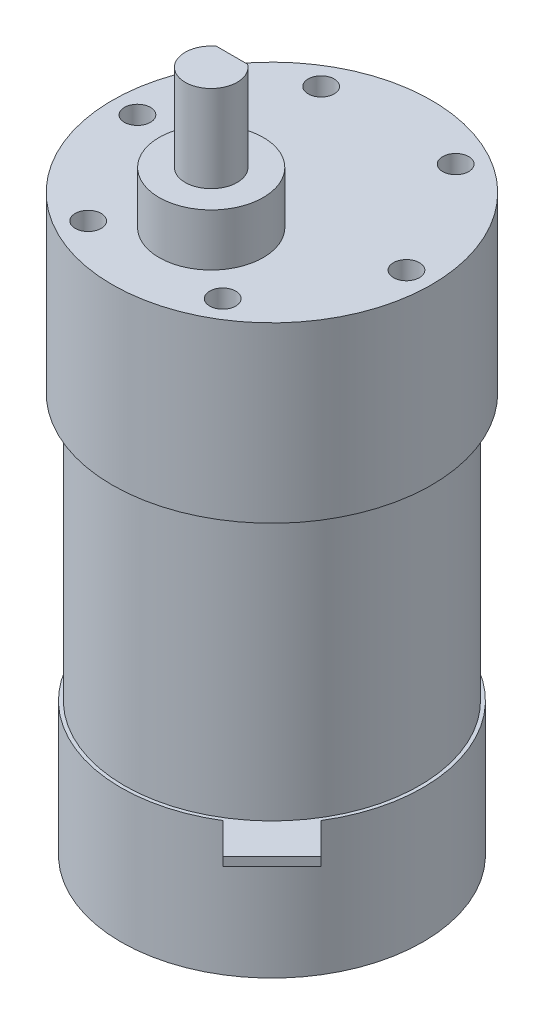
from build123d import *

# Parameters (mm, degrees)
SKETCH1_R           = 17.4
BOSS_EXTRUDE1_DEPTH = 15.4
SKETCH6_R           = 17
BOSS_EXTRUDE5_DEPTH = 30.7
SKETCH7_R           = 18.4
BOSS_EXTRUDE6_DEPTH = 20
SKETCH2_R           = 6
BOSS_EXTRUDE2_DEPTH = 6
SKETCH3_R           = 3
BOSS_EXTRUDE4_DEPTH = 10
SKETCH4_W           = 6
SKETCH4_H           = 8
CUT_EXTRUDE1_DEPTH  = 10
BOSS_EXTRUDE7_DEPTH = 1
SKETCH5_R           = 1.5
CUT_EXTRUDE2_DEPTH  = 3


with BuildPart() as part:
    # Sketch1 → Boss-Extrude1 (new body)
    with BuildSketch(Plane(origin=(0, 0, 0), x_dir=(1, 0, 0), z_dir=(0, 1, 0))):
        Circle(SKETCH1_R)
    extrude(amount=BOSS_EXTRUDE1_DEPTH)

    # Sketch6 → Boss-Extrude5 (add)
    with BuildSketch(Plane(origin=(0, 15.4, 0), x_dir=(1, 0, 0), z_dir=(0, 1, 0))):
        Circle(SKETCH6_R)
    extrude(amount=BOSS_EXTRUDE5_DEPTH)

    # Sketch7 → Boss-Extrude6 (add)
    with BuildSketch(Plane(origin=(0, 46.1, 0), x_dir=(1, 0, 0), z_dir=(0, 1, 0))):
        Circle(SKETCH7_R)
    extrude(amount=BOSS_EXTRUDE6_DEPTH)

    # Sketch2 → Boss-Extrude2 (add)
    with BuildSketch(Plane(origin=(0, 66.1, 0), x_dir=(1, 0, 0), z_dir=(0, 1, 0))):
        with Locations((0, -7)):
            Circle(SKETCH2_R)
    extrude(amount=BOSS_EXTRUDE2_DEPTH)

    # Sketch3 → Boss-Extrude4 (add)
    with BuildSketch(Plane(origin=(0, 72.1, 0), x_dir=(1, 0, 0), z_dir=(0, 1, 0))):
        with Locations((0, -7)):
            Circle(SKETCH3_R)
    extrude(amount=BOSS_EXTRUDE4_DEPTH)

    # Sketch4 → Cut-Extrude1 (cut)
    with BuildSketch(Plane.XY.offset(4.6)):
        with Locations((0, 78.1)):
            Rectangle(SKETCH4_W, SKETCH4_H)
    extrude(amount=-CUT_EXTRUDE1_DEPTH, mode=Mode.SUBTRACT)

    # Sketch8 → Boss-Extrude7 (add)
    with BuildSketch(Plane.XZ.offset(-15.4)):
        Polygon((2.828427125, -2.828427125), (-2.828427125, 2.828427125), (12.727922061, 18.384776311), (18.384776311, 12.727922061), align=None)
    extrude(amount=BOSS_EXTRUDE7_DEPTH)

    # Sketch5 → Cut-Extrude2 (cut)
    with BuildSketch(Plane(origin=(0, 66.1, 0), x_dir=(1, 0, 0), z_dir=(0, 1, 0))):
        with Locations((-7.75, 13.423393759)):
            Circle(SKETCH5_R)
        with Locations((7.75, 13.423393759)):
            Circle(SKETCH5_R)
        with Locations((-15.5, 0)):
            Circle(SKETCH5_R)
        with Locations((15.5, 0)):
            Circle(SKETCH5_R)
        with Locations((7.75, -13.423393759)):
            Circle(SKETCH5_R)
        with Locations((-7.75, -13.423393759)):
            Circle(SKETCH5_R)
    extrude(amount=-CUT_EXTRUDE2_DEPTH, mode=Mode.SUBTRACT)


solid = part.part
